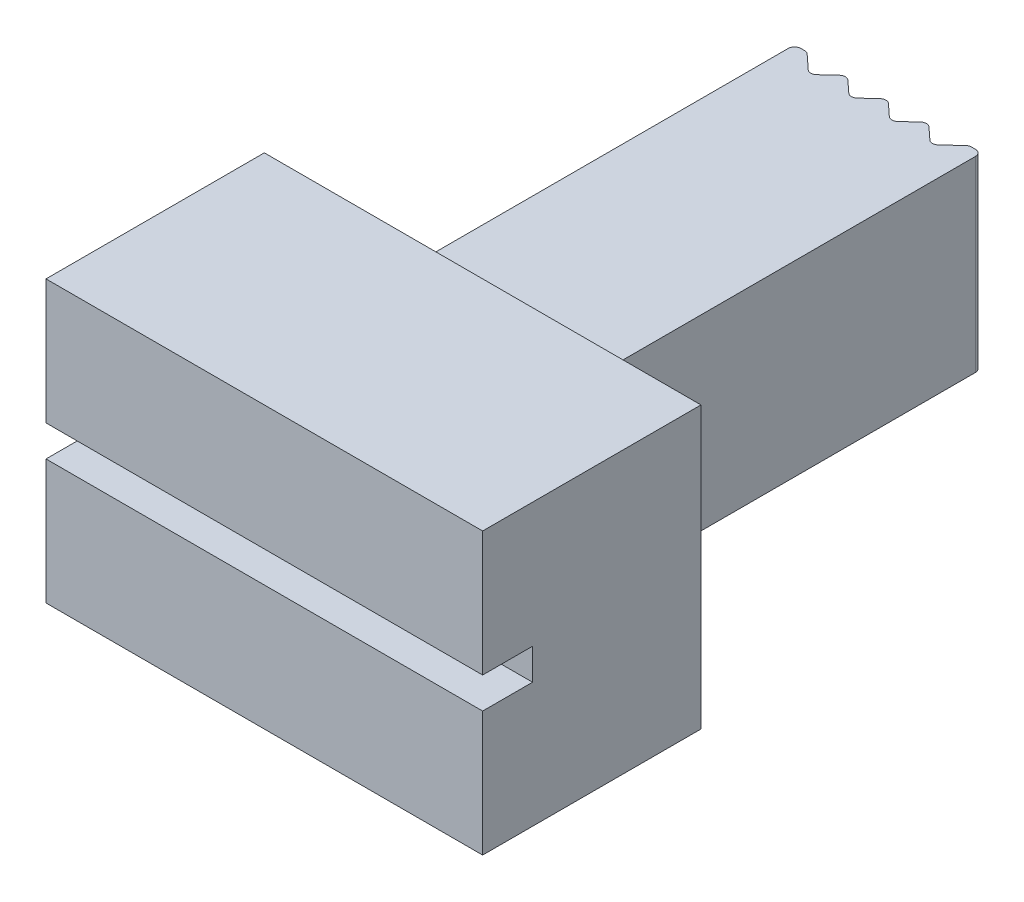
from build123d import *

# Parameters (mm, degrees)
SKETCH_1_W          = 7
SKETCH_1_H          = 4.5
EXTRUDE_1_DEPTH     = 3.5
SKETCH_3_W          = 3
SKETCH_3_H          = 3
EXTRUDE_2_DEPTH     = 6.5
SKETCH_4_W          = 1.6
SKETCH_4_H          = 0.5
CUT_EXTRUDE_1_DEPTH = 10.813893213
CUT_EXTRUDE_2_DEPTH = 6.5
FILLET_1_R          = 0.1


with BuildPart() as part:
    # 草图1 → 凸台-拉伸1 (new body)
    with BuildSketch(Plane.XY):
        Rectangle(SKETCH_1_W, SKETCH_1_H)
    extrude(amount=EXTRUDE_1_DEPTH)

    # 草图3 → 凸台-拉伸2 (add)
    with BuildSketch(Plane(origin=(0, 0, 0), x_dir=(-1, 0, 0), z_dir=(0, 0, -1))):
        Rectangle(SKETCH_3_W, SKETCH_3_H)
    extrude(amount=EXTRUDE_2_DEPTH)

    # 草图4 → 切除-拉伸1 (cut, through all)
    with BuildSketch(Plane(origin=(3.5, 0, 0), x_dir=(0, 0, -1), z_dir=(1, 0, 0))):
        with Locations((-3.5, 0)):
            Rectangle(SKETCH_4_W, SKETCH_4_H)
    extrude(amount=-CUT_EXTRUDE_1_DEPTH, mode=Mode.SUBTRACT)

    # 草图5 → 切除-拉伸2 (cut)
    with BuildSketch(Plane(origin=(0, 1.5, 0), x_dir=(1, 0, 0), z_dir=(0, 1, 0))):
        Polygon((-0.65, 6.5), (-1.3, 6.5), (-0.975, 6.2), align=None)
        Polygon((0, 6.5), (-0.65, 6.5), (-0.325, 6.2), align=None)
        Polygon((0.65, 6.5), (0, 6.5), (0.325, 6.2), align=None)
        Polygon((1.3, 6.5), (0.65, 6.5), (0.975, 6.2), align=None)
    extrude(amount=-CUT_EXTRUDE_2_DEPTH, mode=Mode.SUBTRACT)

    # 圆角1
    fillet_1_edges = [part.edges().sort_by_distance(p)[0] for p in [
        (1.5, 0, -6.5),
        (-1.5, 0, -6.5),
        (0.65, 0, -6.5),
        (0, 0, -6.5),
        (-0.65, 0, -6.5),
        (-1.3, 0, -6.5),
        (-0.975, 0, -6.2),
        (0.325, 0, -6.2),
        (-0.325, 0, -6.2),
        (1.3, 0, -6.5),
        (0.975, 0, -6.2),
    ]]
    fillet(fillet_1_edges, radius=FILLET_1_R)


solid = part.part
